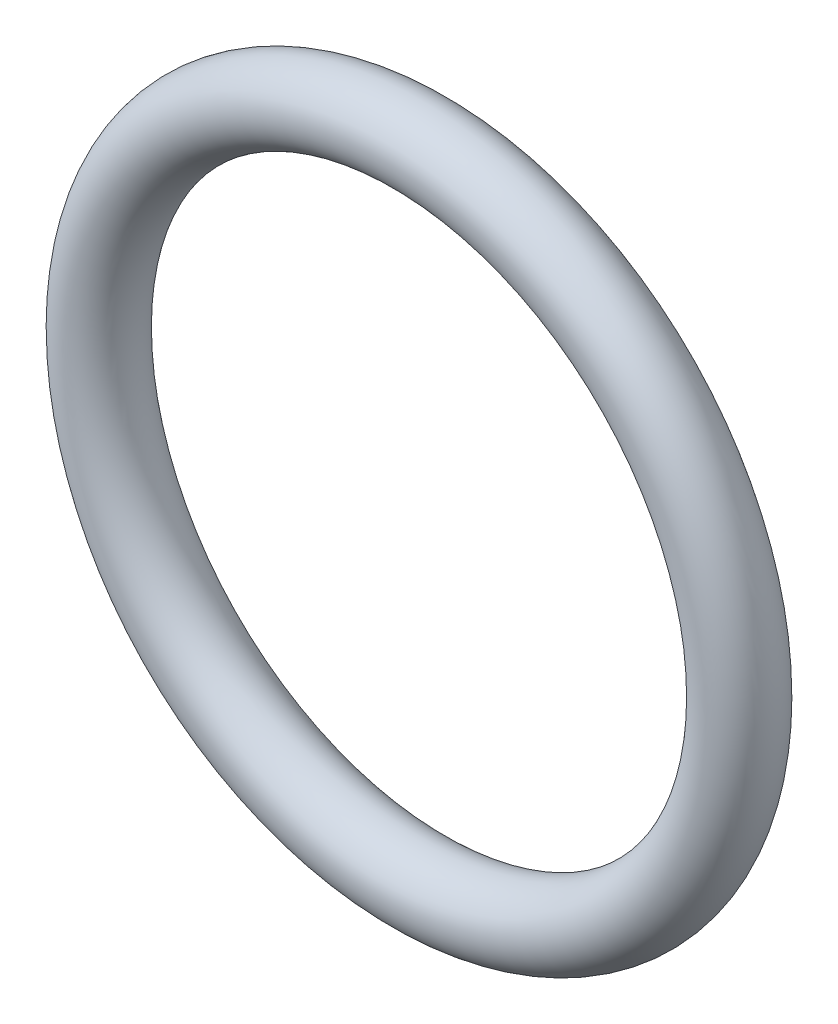
from build123d import *

# Parameters (mm, degrees)
SKETCH_1_R = 1.25


with BuildPart() as part:
    # Эскиз1 → Повернуть1 (revolve)
    with BuildSketch(Plane(origin=(0, 0, 0), x_dir=(1, 0, 0), z_dir=(0, 1, 0))):
        with Locations((10.75, 0)):
            Circle(SKETCH_1_R)
    revolve(axis=Axis((0, 0, 0), (0, 0, -1)))


solid = part.part
